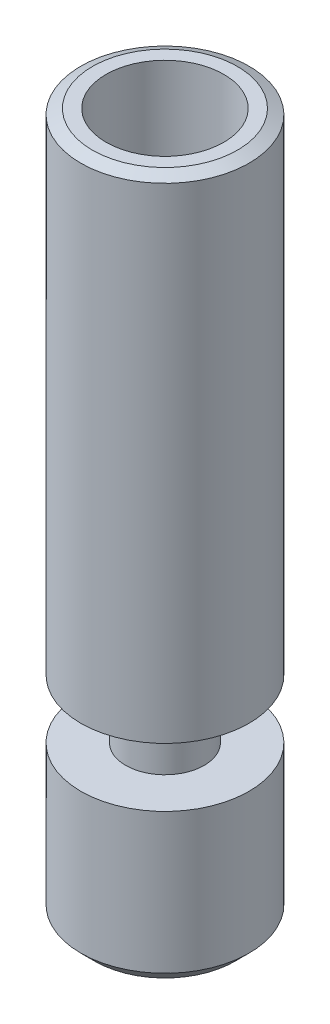
from build123d import *


with BuildPart() as part:
    # Sketch1 → Revolve1 (revolve)
    with BuildSketch(Plane(origin=(0, 0, 0), x_dir=(-1, 0, 0), z_dir=(0, 0, -1)), mode=Mode.PRIVATE) as revolve1_sk:
        Polygon((-2.5, -0.5), (-1, -0.5), (-1, 15.3), (-2.1, 16.4), (-2.1, 24.596326416), (-2.586760365, 24.596326416), (-3, 24.4), (-3, 16.9), (-3, 7.1), (-1.4, 7.1), (-1.4, 5), (-3, 5), (-3, 0), align=None)
    revolve(revolve1_sk.sketch.rotate(Axis((0, -0.5, 0), (0, 1, 0)), 270), axis=Axis((0, -0.5, 0), (0, 1, 0)))


solid = part.part
